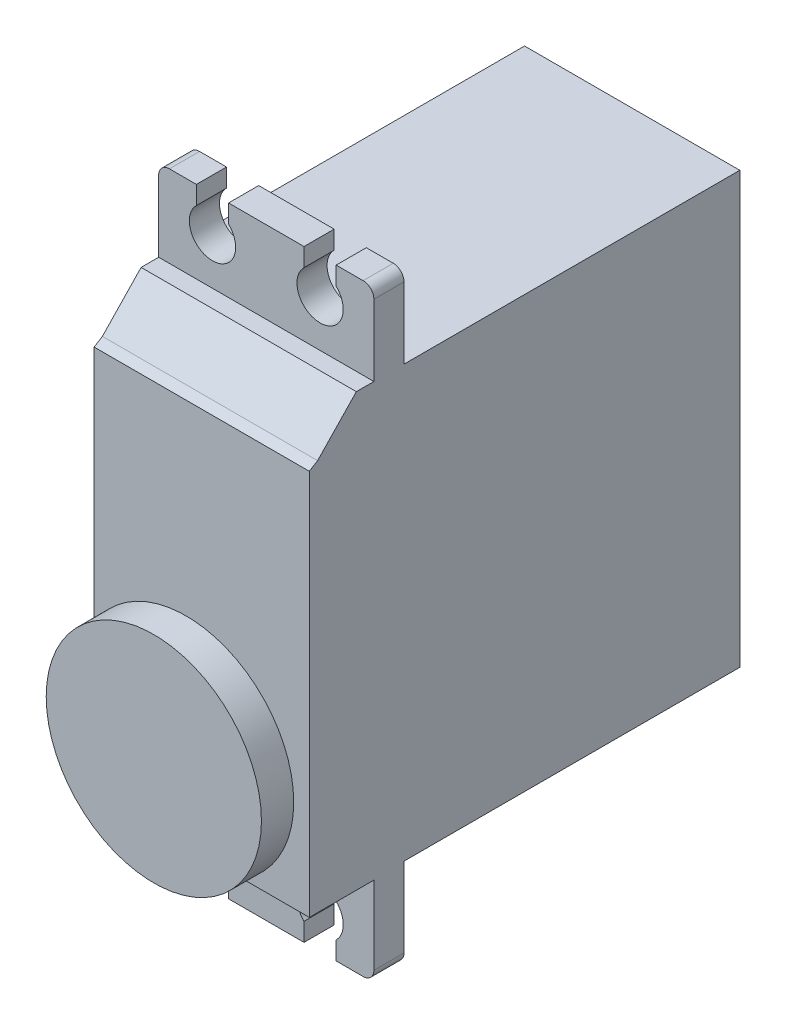
from build123d import *

# Parameters (mm, degrees)
SKETCH1_R           = 2.71138536
BOSS_EXTRUDE2_DEPTH = 2.8
FILLET1_R           = 1
BOSS_EXTRUDE4_REACH = 71.688
SKETCH5_W           = 31.2
SKETCH5_H           = 40
CUT_EXTRUDE1_DEPTH  = 143.310868606
SKETCH7_W           = 29.686403428
SKETCH7_H           = 9.387658688
SKETCH7_W_2         = 27.535306267
SKETCH7_H_2         = 10.174748845
CUT_EXTRUDE2_DEPTH  = 143.310868606
SKETCH9_R           = 3.527564699
BOSS_EXTRUDE5_DEPTH = 4.45
SKETCH8_W           = 7.436989159
SKETCH8_H           = 16.512703909
CUT_EXTRUDE4_DEPTH  = 77.302474202
SKETCH11_R          = 5
BOSS_EXTRUDE6_DEPTH = 1.45
SKETCH12_R          = 10
BOSS_EXTRUDE7_DEPTH = 3


with BuildPart() as part:
    # Sketch1 → Boss-Extrude2 (new body)
    with BuildSketch(Plane.XY):
        with BuildLine():
            Line((101.027913119, 66.698032725), (101.027913119, 10.698032725))
            Line((101.027913119, 10.698032725), (104.53416083, 10.698032725))
            Line((104.53416083, 10.698032725), (104.53416083, 12.400036101))
            ThreePointArc((104.53416083, 12.400036101), (105.187004527, 15.928048429), (108.179096386, 13.948032725))
            ThreePointArc((108.179096386, 13.948032725), (108.007928823, 13.107124133), (107.521665407, 12.400036101))
            Line((107.521665407, 12.400036101), (107.521665407, 10.698032725))
            Line((107.521665407, 10.698032725), (114.53416083, 10.698032725))
            Line((114.53416083, 10.698032725), (114.53416083, 12.400036101))
            ThreePointArc((114.53416083, 12.400036101), (115.187004527, 15.928048429), (118.179096386, 13.948032725))
            ThreePointArc((118.179096386, 13.948032725), (118.007928823, 13.107124133), (117.521665407, 12.400036101))
            Line((117.521665407, 12.400036101), (117.521665407, 10.698032725))
            Line((117.521665407, 10.698032725), (121.027913119, 10.698032725))
            Line((121.027913119, 10.698032725), (121.027913119, 66.698032725))
            Line((121.027913119, 66.698032725), (117.521665407, 66.698032725))
            Line((117.521665407, 66.698032725), (117.521665407, 64.996029349))
            ThreePointArc((117.521665407, 64.996029349), (118.007928823, 64.288941317), (118.179096386, 63.448032725))
            ThreePointArc((118.179096386, 63.448032725), (115.187004527, 61.468017021), (114.53416083, 64.996029349))
            Line((114.53416083, 64.996029349), (114.53416083, 66.698032725))
            Line((114.53416083, 66.698032725), (107.521665407, 66.698032725))
            Line((107.521665407, 66.698032725), (107.521665407, 64.996029349))
            ThreePointArc((107.521665407, 64.996029349), (108.007928823, 64.288941317), (108.179096386, 63.448032725))
            ThreePointArc((108.179096386, 63.448032725), (105.187004527, 61.468017021), (104.53416083, 64.996029349))
            Line((104.53416083, 64.996029349), (104.53416083, 66.698032725))
            Line((104.53416083, 66.698032725), (101.027913119, 66.698032725))
        make_face()
        with Locations((111.027913119, 28.948032725)):
            Circle(SKETCH1_R, mode=Mode.SUBTRACT)
    extrude(amount=BOSS_EXTRUDE2_DEPTH)

    # Fillet1
    fillet1_edges = [part.edges().sort_by_distance(p)[0] for p in [
        (101.027913119, 10.698032725, 1.4),
        (101.027913119, 66.698032725, 1.4),
        (121.027913119, 66.698032725, 1.4),
        (121.027913119, 10.698032725, 1.4),
    ]]
    fillet(fillet1_edges, radius=FILLET1_R)

    # Boss-Extrude4: up to this face of the body (flat: up to its plane)
    boss_extrude4_end = Plane(part.part.faces().sort_by_distance((121.027913119, 38.698032725, 1.4))[0])
    # Sketch5 → Boss-Extrude4 (add, up to the picked face)
    with BuildSketch(Plane.ZY.offset(-101.027913119), mode=Mode.PRIVATE) as boss_extrude4_sk1:
        Polygon((4.36856715, 64.103331084), (2.8, 64.103331084), (2.8, 13.685897531), (3.764993714, 13.685897531), (3.764993714, 18.958103522), (8.8, 18.958103522), (8.8, 22.695834212), (9.718562106, 23.589991727), (9.718562106, 25.946850167), (13.25, 25.946850167), (13.25, 32.391247199), (9.718562106, 32.391247199), (9.718562106, 35.074245433), (8.8, 35.635588942), (8.8, 54.857740136), (8.029983718, 55.328305642), (4.432571629, 59.081605588), (4.36856715, 59.081605588), align=None)
    boss_extrude4_tool1 = split(extrude(boss_extrude4_sk1.sketch, amount=-BOSS_EXTRUDE4_REACH, mode=Mode.PRIVATE), bisect_by=boss_extrude4_end, keep=Keep.BOTH, mode=Mode.PRIVATE)
    # Sketch5 → Boss-Extrude4 (add, up to the picked face)
    with BuildSketch(Plane.ZY.offset(-101.027913119), mode=Mode.PRIVATE) as boss_extrude4_sk2:
        with Locations((-15.6, 39.081605588)):
            Rectangle(SKETCH5_W, SKETCH5_H)
    boss_extrude4_tool2 = split(extrude(boss_extrude4_sk2.sketch, amount=-BOSS_EXTRUDE4_REACH, mode=Mode.PRIVATE), bisect_by=boss_extrude4_end, keep=Keep.BOTH, mode=Mode.PRIVATE)
    add(boss_extrude4_tool1.solids().sort_by(Axis((101.027913, 37.386075, 6.241915), (1, 0, 0)))[0])
    add(boss_extrude4_tool2.solids().sort_by(Axis((101.027913, 39.081606, -15.6), (1, 0, 0)))[0])

    # Sketch6 → Cut-Extrude1 (cut, through all)
    with BuildSketch(Plane(origin=(0, 0, 2.8), x_dir=(-1, 0, 0), z_dir=(0, 0, -1))):
        with BuildLine():
            Line((-113.978968632, 64.103331084), (-118.076857605, 64.103331084))
            ThreePointArc((-118.076857605, 64.103331084), (-116.027913119, 61.296849458), (-113.978968632, 64.103331084))
        make_face()
        with BuildLine():
            Line((-103.978968632, 64.103331084), (-108.076857605, 64.103331084))
            ThreePointArc((-108.076857605, 64.103331084), (-106.027913119, 61.296849458), (-103.978968632, 64.103331084))
        make_face()
        with BuildLine():
            Line((-118.163065242, 13.685897531), (-113.892760996, 13.685897531))
            ThreePointArc((-113.892760996, 13.685897531), (-116.027913119, 16.099215992), (-118.163065242, 13.685897531))
        make_face()
        with BuildLine():
            Line((-108.163065242, 13.685897531), (-103.892760996, 13.685897531))
            ThreePointArc((-103.892760996, 13.685897531), (-106.027913119, 16.099215992), (-108.163065242, 13.685897531))
        make_face()
    extrude(amount=-CUT_EXTRUDE1_DEPTH, mode=Mode.SUBTRACT)

    # Sketch7 → Cut-Extrude2 (cut, through all)
    with BuildSketch(Plane.XY.offset(2.8)):
        with Locations((110.258958877, 63.775434932)):
            Rectangle(SKETCH7_W, SKETCH7_H)
        with Locations((111.334507458, 13.8707291)):
            Rectangle(SKETCH7_W_2, SKETCH7_H_2)
    extrude(amount=CUT_EXTRUDE2_DEPTH, mode=Mode.SUBTRACT)

    # Sketch8 → Cut-Extrude4 (cut, through all)
    with BuildSketch(Plane.ZY.offset(-101.027913119)):
        with Locations((12.51849458, 29.114960016)):
            Rectangle(SKETCH8_W, SKETCH8_H)
    extrude(amount=-CUT_EXTRUDE4_DEPTH, mode=Mode.SUBTRACT)



with BuildPart() as body_2:
    # Sketch9 → Boss-Extrude5 (new, through all)
    with BuildSketch(Plane.XY.offset(8.8)):
        with Locations((111.027913119, 28.948032725)):
            Circle(SKETCH9_R)
    extrude(amount=BOSS_EXTRUDE5_DEPTH)


with BuildPart() as part_1:
    add(part.part)

    add(body_2.part)  # Boss-Extrude6 merges body 2
    # Sketch11 → Boss-Extrude6 (add)
    with BuildSketch(Plane.XY.offset(8.8)):
        with Locations((111.027913119, 28.948032725)):
            Circle(SKETCH11_R)
    extrude(amount=BOSS_EXTRUDE6_DEPTH)

    # Sketch12 → Boss-Extrude7 (add)
    with BuildSketch(Plane.XY.offset(10.25)):
        with Locations((111.027913119, 28.948032725)):
            Circle(SKETCH12_R)
    extrude(amount=BOSS_EXTRUDE7_DEPTH)


solid = part_1.part
